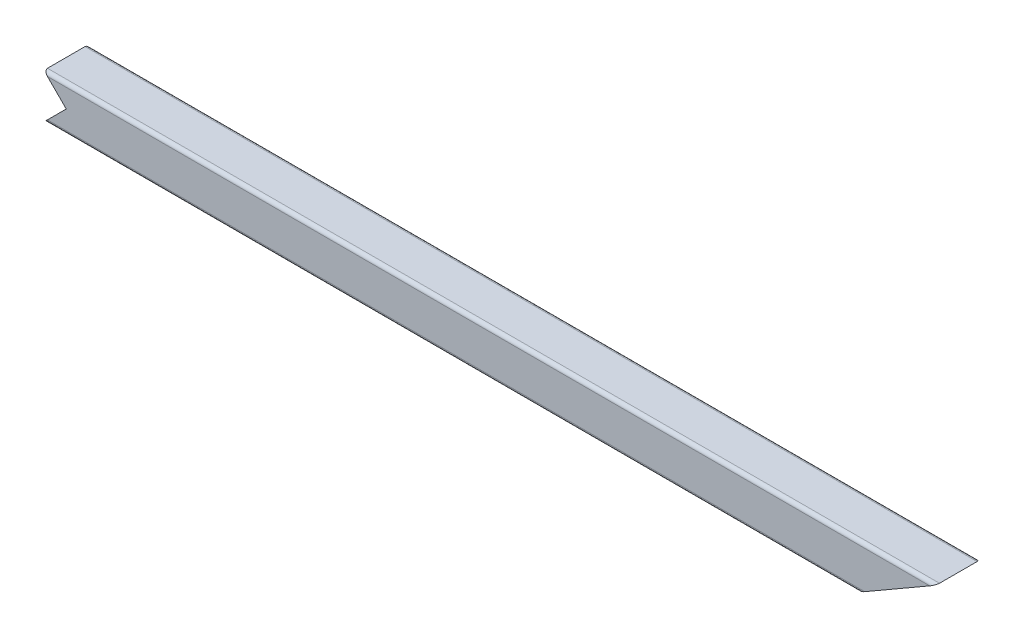
from build123d import *

# Parameters (mm, degrees)
SKETCH1_W           = 23.495
SKETCH1_H           = 23.495
BOSS_EXTRUDE1_DEPTH = 508
SCALE1_SCALE_X      = 1
SCALE1_SCALE_Y      = 0.4
SCALE1_SCALE_Z      = 0.4
CUT_EXTRUDE1_REACH  = 510.645
CUT_EXTRUDE2_REACH  = 510.645


with BuildPart() as part:
    # Sketch1 → Boss-Extrude1 (new body)
    with BuildSketch(Plane(origin=(0, 0, 0), x_dir=(0, 0, -1), z_dir=(1, 0, 0))):
        with BuildLine():
            Line((0, 2.54), (0, 29.21))
            ThreePointArc((0, 29.21), (-0.743948776, 31.006051224), (-2.54, 31.75))
            Line((-2.54, 31.75), (-29.21, 31.75))
            ThreePointArc((-29.21, 31.75), (-31.006051224, 31.006051224), (-31.75, 29.21))
            Line((-31.75, 29.21), (-31.75, 2.54))
            ThreePointArc((-31.75, 2.54), (-31.006051224, 0.743948776), (-29.21, 0))
            Line((-29.21, 0), (-2.54, 0))
            ThreePointArc((-2.54, 0), (-0.743948776, 0.743948776), (0, 2.54))
        make_face()
        with Locations((-15.875, 15.875)):
            Rectangle(SKETCH1_W, SKETCH1_H, mode=Mode.SUBTRACT)
    extrude(amount=BOSS_EXTRUDE1_DEPTH)


with BuildPart() as part_1:
    # Scale1: scaled about (254, 15.875, 15.875)
    add(part.part.scale((SCALE1_SCALE_X, SCALE1_SCALE_Y, SCALE1_SCALE_Z), about=(254, 15.875, 15.875)))

    # Sketch2 → Cut-Extrude1 (cut, up to next)
    with BuildSketch(Plane(origin=(0, 0, 9.525), x_dir=(-1, 0, 0), z_dir=(0, 0, -1)), mode=Mode.PRIVATE) as cut_extrude1_sk1:
        Polygon((-158.75, 15.875), (-152.4, 9.525), (-132.341002805, 9.525), (-132.341002805, 22.225), (-152.4, 22.225), align=None)
    cut_extrude1_tool1 = extrude(cut_extrude1_sk1.sketch, amount=-CUT_EXTRUDE1_REACH, mode=Mode.PRIVATE) & part_1.part
    add(cut_extrude1_tool1.solids().sort_by_distance((144.030314, 15.875, 9.525))[0], mode=Mode.SUBTRACT)


with BuildPart() as cut_extrude1_kept_piece:
    # of the separate pieces the step leaves, the one the design keeps (cut_extrude1_pieces_kept)
    add(part_1.part.solids().sort_by_distance((158.75, 15.875, 9.525))[0])

    # Sketch3 → Cut-Extrude2 (cut, up to next)
    with BuildSketch(Plane(origin=(0, 0, 9.525), x_dir=(-1, 0, 0), z_dir=(0, 0, -1)), mode=Mode.PRIVATE) as cut_extrude2_sk1:
        Polygon((-406.004091145, 22.225), (-384.007045889, 9.525), (-508, 9.525), (-508, 22.225), align=None)
    cut_extrude2_tool1 = extrude(cut_extrude2_sk1.sketch, amount=-CUT_EXTRUDE2_REACH, mode=Mode.PRIVATE) & cut_extrude1_kept_piece.part
    add(cut_extrude2_tool1.solids().sort_by_distance((451.324357, 15.66897, 9.525))[0], mode=Mode.SUBTRACT)


solid = cut_extrude1_kept_piece.part
